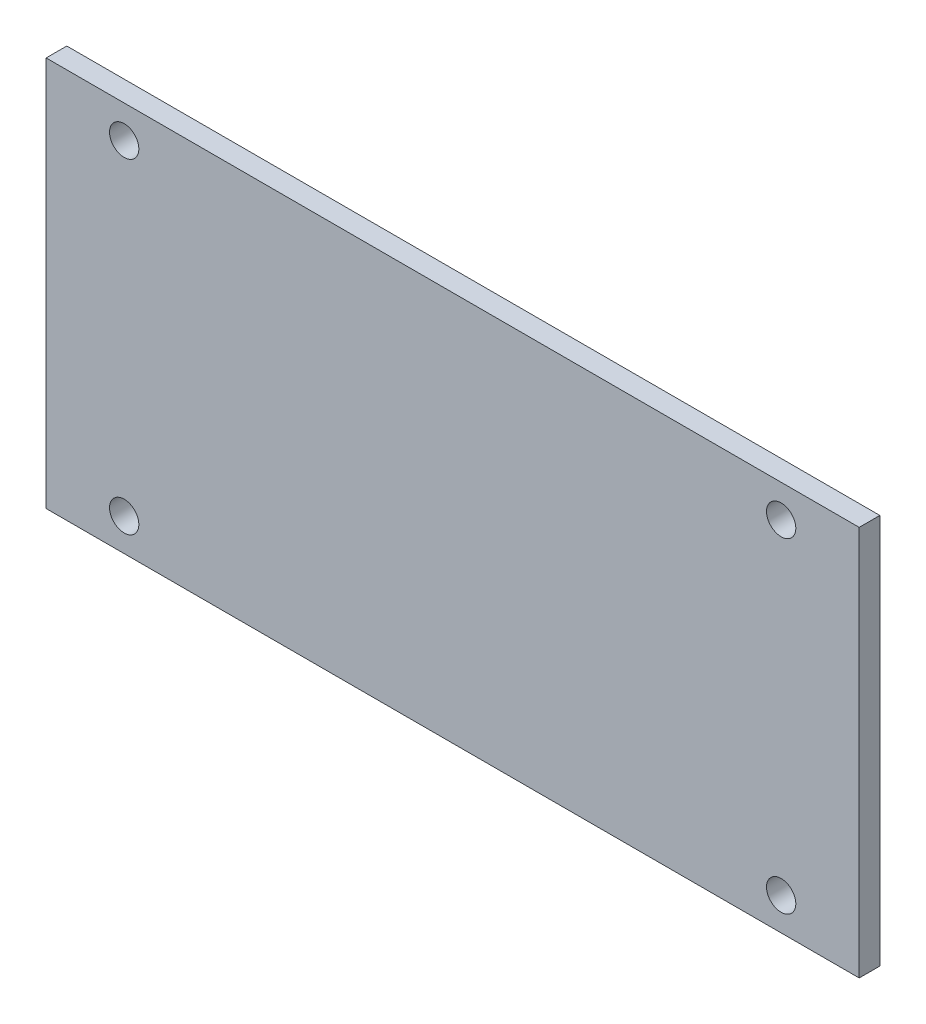
from build123d import *

# Parameters (mm, degrees)
SKETCH1_W           = 125
SKETCH1_H           = 60
BOSS_EXTRUDE1_DEPTH = 3.175
SKETCH2_R           = 2.25
CUT_EXTRUDE2_DEPTH  = 3.175


with BuildPart() as part:
    # Sketch1 → Boss-Extrude1 (new body)
    with BuildSketch(Plane.XY):
        Rectangle(SKETCH1_W, SKETCH1_H)
    extrude(amount=BOSS_EXTRUDE1_DEPTH)

    # Sketch2 → Cut-Extrude2 (cut)
    with BuildSketch(Plane.XY.offset(3.175)):
        with Locations((-50.5, 25)):
            Circle(SKETCH2_R)
        with Locations((-50.5, -25)):
            Circle(SKETCH2_R)
        with Locations(Location((50.5, -25, 0), (0, 0, 180))):
            Circle(SKETCH2_R)
        with Locations(Location((50.5, 25, 0), (0, 0, 180))):
            Circle(SKETCH2_R)
    extrude(amount=-CUT_EXTRUDE2_DEPTH, mode=Mode.SUBTRACT)


solid = part.part
